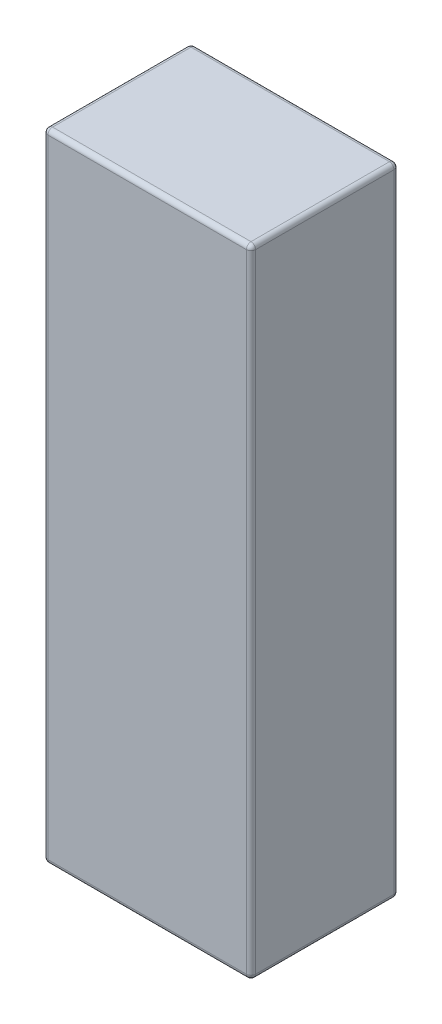
from build123d import *

# Parameters (mm, degrees)
SKETCH1_W           = 45
SKETCH1_H           = 138
BOSS_EXTRUDE1_DEPTH = 32
FILLET1_R           = 1
CUT_EXTRUDE1_DEPTH  = 2


with BuildPart() as part:
    # Sketch1 → Boss-Extrude1 (new body)
    with BuildSketch(Plane.XY):
        Rectangle(SKETCH1_W, SKETCH1_H)
    extrude(amount=BOSS_EXTRUDE1_DEPTH)

    # Fillet1
    fillet1_edges = [part.edges().sort_by_distance(p)[0] for p in [
        (-22.5, 0, 32),
        (0, -69, 32),
        (22.5, 0, 32),
        (0, -69, 0),
        (-22.5, 0, 0),
        (0, 69, 0),
        (22.5, 0, 0),
        (0, 69, 32),
        (22.5, -69, 16),
        (-22.5, -69, 16),
        (-22.5, 69, 16),
        (22.5, 69, 16),
    ]]
    fillet(fillet1_edges, radius=FILLET1_R)

    # Sketch2 → Cut-Extrude1 (cut)
    # profile 1 of 7: a face of its own
    with BuildSketch(Plane(origin=(0, 0, 0), x_dir=(-1, 0, 0), z_dir=(0, 0, -1))):
        with BuildLine():
            Line((-7.277134392, -1.295430919), (-7.277134392, 2.204569081))
            Line((-7.277134392, 2.204569081), (-6.716236956, 2.204569081))
            add(Edge.make_bspline(
                [(-6.716236956, 2.204569081), (-6.676970628, 2.204573562), (-6.600991029, 2.204582233), (-6.491372295, 2.200732783), (-6.389710178, 2.195753088), (-6.296328204, 2.190181968), (-6.211067432, 2.180581814), (-6.134057514, 2.1704643), (-6.065144584, 2.158263203), (-6.022539465, 2.14731844), (-6.002494969, 2.142169241)],
                knots=[0, 0, 0, 0, 1.311965854, 2.538629056, 3.664479157, 4.713267157, 5.663616078, 6.530575999, 7.308677837, 8, 8, 8, 8], degree=3))
            add(Edge.make_bspline(
                [(-6.002494969, 2.142169241), (-5.97617451, 2.134906204), (-5.924525321, 2.120653793), (-5.8505472, 2.091870433), (-5.780368633, 2.059875689), (-5.714075306, 2.023375669), (-5.652074286, 1.981929717), (-5.594601198, 1.935208904), (-5.540416491, 1.885088603), (-5.491444139, 1.830171975), (-5.447181202, 1.772142384), (-5.408724645, 1.711015037), (-5.375310826, 1.64772461), (-5.348571019, 1.581474634), (-5.328423077, 1.512570211), (-5.313686956, 1.441305571), (-5.304135954, 1.367455215), (-5.30323351, 1.317212405), (-5.302775417, 1.291708504)],
                knots=[0, 0, 0, 0, 1.099996261, 2.158545794, 3.195537121, 4.207578794, 5.205712374, 6.197378256, 7.190519799, 8.17788031, 9.159561366, 10.129234751, 11.085776129, 12.040971148, 13.00380137, 13.975669004, 14.972423361, 16, 16, 16, 16], degree=3))
            add(Edge.make_bspline(
                [(-5.302775417, 1.291708504), (-5.303973193, 1.258942685), (-5.306330867, 1.194447196), (-5.321391852, 1.099714991), (-5.349633544, 1.010179442), (-5.386587111, 0.924190441), (-5.436832408, 0.842068729), (-5.500634219, 0.763853351), (-5.576959163, 0.68713594), (-5.635504607, 0.641149027), (-5.665956507, 0.617229337)],
                knots=[0, 0, 0, 0, 0.986156485, 1.941127874, 2.875419072, 3.804401753, 4.751181392, 5.761612777, 6.835722519, 8, 8, 8, 8], degree=3))
            add(Edge.make_bspline(
                [(-5.665956507, 0.617229337), (-5.641279749, 0.604632066), (-5.592895452, 0.579932302), (-5.524203966, 0.539333264), (-5.460603148, 0.496151038), (-5.401807831, 0.451254467), (-5.349051315, 0.402740322), (-5.300155194, 0.353404053), (-5.25753175, 0.300418899), (-5.219416581, 0.24567335), (-5.186287496, 0.188374684), (-5.157435716, 0.128619667), (-5.133065652, 0.066204162), (-5.112428452, 0.001445813), (-5.097037222, -0.065878117), (-5.087001814, -0.135791707), (-5.079318077, -0.208056517), (-5.078720355, -0.2572815), (-5.078416443, -0.282309926)],
                knots=[0, 0, 0, 0, 1.164658916, 2.283573913, 3.35186032, 4.395461096, 5.390182219, 6.362969632, 7.312859996, 8.245001507, 9.165155236, 10.092416118, 11.032087915, 11.979892451, 12.947605196, 13.931445124, 14.948243989, 16, 16, 16, 16], degree=3))
            add(Edge.make_bspline(
                [(-5.078416443, -0.282309926), (-5.080388627, -0.330112788), (-5.084280725, -0.424451545), (-5.112737846, -0.562962506), (-5.162073451, -0.694283461), (-5.228320996, -0.817892482), (-5.309950717, -0.930211293), (-5.403801487, -1.028601596), (-5.508928445, -1.111886803), (-5.60592077, -1.168097857), (-5.689811493, -1.20582073), (-5.759296611, -1.22914339), (-5.833922155, -1.250749466), (-5.915055086, -1.265921699), (-6.001224574, -1.279808995), (-6.093270777, -1.288383299), (-6.191021663, -1.294193894), (-6.258161197, -1.295010241), (-6.292759392, -1.295430919)],
                knots=[0, 0, 0, 0, 1.284142165, 2.534249414, 3.780121997, 5.041676246, 6.291546858, 7.49970053, 8.684500223, 9.883330709, 10.50184324, 11.153274765, 11.851151195, 12.587658647, 13.369265475, 14.195992086, 15.070362669, 16, 16, 16, 16], degree=3))
            Line((-6.292759392, -1.295430919), (-7.277134392, -1.295430919))
        make_face()
        with BuildLine():
            Line((-6.648929264, 1.576363952), (-6.648929264, 0.81354344))
            Line((-6.648929264, 0.81354344), (-6.482062276, 0.81354344))
            add(Edge.make_bspline(
                [(-6.482062276, 0.81354344), (-6.459383554, 0.813741207), (-6.415603652, 0.814122984), (-6.352368227, 0.819040143), (-6.293569495, 0.827429122), (-6.239430465, 0.839133858), (-6.189446813, 0.853997166), (-6.14393785, 0.871880927), (-6.103103669, 0.893701059), (-6.055663795, 0.926203108), (-6.005516427, 0.974031329), (-5.961372263, 1.043129103), (-5.935371645, 1.122591281), (-5.932475878, 1.178634161), (-5.930980546, 1.207573888)],
                knots=[0, 0, 0, 0, 1.065314748, 2.056525647, 2.977365736, 3.853934255, 4.656397591, 5.425096493, 6.14721249, 6.826394842, 8.123232004, 9.372140726, 10.643011755, 12, 12, 12, 12], degree=3))
            add(Edge.make_bspline(
                [(-5.930980546, 1.207573888), (-5.932177085, 1.234680751), (-5.934490546, 1.287090781), (-5.960669825, 1.36067913), (-6.001331421, 1.425893468), (-6.04933815, 1.470527349), (-6.094545815, 1.501010974), (-6.133255391, 1.521083143), (-6.175742057, 1.539051544), (-6.222828311, 1.55279062), (-6.274245262, 1.56309994), (-6.329743152, 1.570670901), (-6.389417732, 1.575824019), (-6.430635091, 1.576180114), (-6.451914039, 1.576363952)],
                knots=[0, 0, 0, 0, 1.347982417, 2.606269829, 3.849316587, 5.153353503, 5.842674298, 6.568177932, 7.326619318, 8.142485038, 9.012069166, 9.942760135, 10.937925643, 12, 12, 12, 12], degree=3))
            Line((-6.451914039, 1.576363952), (-6.648929264, 1.576363952))
        make_face(mode=Mode.SUBTRACT)
        with BuildLine():
            Line((-6.648929264, 0.230210106), (-6.648929264, -0.667225791))
            Line((-6.648929264, -0.667225791), (-6.46803984, -0.667225791))
            add(Edge.make_bspline(
                [(-6.46803984, -0.667225791), (-6.432277771, -0.667021484), (-6.36352073, -0.666628677), (-6.265026392, -0.661882642), (-6.175470414, -0.653328749), (-6.095090087, -0.642649902), (-6.023762293, -0.628181736), (-5.961728137, -0.609787316), (-5.908136902, -0.589550251), (-5.863309922, -0.564555072), (-5.826688848, -0.535466883), (-5.793642168, -0.505738054), (-5.766697964, -0.471443042), (-5.745379207, -0.434054036), (-5.72692786, -0.394499806), (-5.715799311, -0.351235773), (-5.707326425, -0.305544179), (-5.706860139, -0.273940292), (-5.706621571, -0.257770663)],
                knots=[0, 0, 0, 0, 1.753078804, 3.370512758, 4.83203934, 6.162291463, 7.344201807, 8.395507345, 9.331626367, 10.147333109, 10.898971645, 11.62040215, 12.321813352, 13.025280112, 13.727906689, 14.453419512, 15.208716525, 16, 16, 16, 16], degree=3))
            add(Edge.make_bspline(
                [(-5.706621571, -0.257770663), (-5.707147681, -0.239280437), (-5.708172403, -0.203266452), (-5.716541313, -0.150628169), (-5.731750356, -0.101486839), (-5.750906888, -0.054585852), (-5.77756422, -0.011604427), (-5.809245549, 0.02894486), (-5.847524681, 0.065688886), (-5.890571799, 0.100850065), (-5.940782, 0.131635583), (-5.998178841, 0.158347473), (-6.063074133, 0.180656259), (-6.135668897, 0.19841853), (-6.215644882, 0.213493123), (-6.303585825, 0.222494319), (-6.398759324, 0.229188905), (-6.464754177, 0.229861971), (-6.498889199, 0.230210106)],
                knots=[0, 0, 0, 0, 0.845221588, 1.646264278, 2.427170338, 3.19324141, 3.95557735, 4.731569926, 5.540061037, 6.376114724, 7.268642756, 8.224665384, 9.265483498, 10.400594375, 11.639216012, 12.983232105, 14.439614077, 16, 16, 16, 16], degree=3))
            Line((-6.498889199, 0.230210106), (-6.648929264, 0.230210106))
        make_face(mode=Mode.SUBTRACT)
    # profile 2 of 7: a face of its own
    with BuildSketch(Plane(origin=(0, 0, 0), x_dir=(-1, 0, 0), z_dir=(0, 0, -1))):
        Polygon((-3.372587116, 2.204569081), (-2.789954905, 2.204569081), (-1.376493366, -1.295430919), (-2.047466924, -1.295430919), (-2.31950218, -0.577482201), (-3.844442084, -0.577482201), (-4.11647734, -1.295430919), (-4.786749776, -1.295430919), align=None)
        Polygon((-3.081621571, 1.265766997), (-3.606060674, 0.050722927), (-2.557182469, 0.050722927), align=None, mode=Mode.SUBTRACT)
    # profile 3 of 7: a face of its own
    with BuildSketch(Plane(origin=(0, 0, 0), x_dir=(-1, 0, 0), z_dir=(0, 0, -1))):
        Polygon((-1.219442084, 2.204569081), (0.665173301, 2.204569081), (0.665173301, 1.576363952), (0.036968172, 1.576363952), (0.036968172, -1.295430919), (-0.591236956, -1.295430919), (-0.591236956, 1.576363952), (-1.219442084, 1.576363952), align=None)
    # profile 4 of 7: a face of its own
    with BuildSketch(Plane(origin=(0, 0, 0), x_dir=(-1, 0, 0), z_dir=(0, 0, -1))):
        Polygon((0.799788685, 2.204569081), (2.68440407, 2.204569081), (2.68440407, 1.576363952), (2.056198942, 1.576363952), (2.056198942, -1.295430919), (1.427993813, -1.295430919), (1.427993813, 1.576363952), (0.799788685, 1.576363952), align=None)
    # profile 5 of 7: a face of its own
    with BuildSketch(Plane(origin=(0, 0, 0), x_dir=(-1, 0, 0), z_dir=(0, 0, -1))):
        Polygon((3.177993813, 2.204569081), (5.062609198, 2.204569081), (5.062609198, 1.576363952), (3.806198942, 1.576363952), (3.806198942, 0.903287029), (5.062609198, 0.903287029), (5.062609198, 0.275081901), (3.806198942, 0.275081901), (3.806198942, -0.667225791), (5.062609198, -0.667225791), (5.062609198, -1.295430919), (3.177993813, -1.295430919), align=None)
    # profile 6 of 7: a face of its own
    with BuildSketch(Plane(origin=(0, 0, 0), x_dir=(-1, 0, 0), z_dir=(0, 0, -1))):
        with BuildLine():
            Line((5.690814326, 2.204569081), (6.42278548, 2.204569081))
            add(Edge.make_bspline(
                [(6.42278548, 2.204569081), (6.471168551, 2.204397348), (6.564222824, 2.204067059), (6.698402003, 2.19885597), (6.821664032, 2.19160431), (6.934191412, 2.180538086), (7.035936, 2.165865611), (7.126999769, 2.14856919), (7.207380057, 2.12885621), (7.277754761, 2.104292282), (7.341264452, 2.076584544), (7.400464313, 2.044747844), (7.456660382, 2.009136696), (7.509477048, 1.968814072), (7.559373301, 1.924505367), (7.606443273, 1.87616598), (7.650021822, 1.823386013), (7.689839107, 1.766498968), (7.726129357, 1.706655101), (7.758202327, 1.643772246), (7.78428412, 1.577806673), (7.80733018, 1.509711726), (7.82392951, 1.438513975), (7.835474101, 1.364906542), (7.843926599, 1.288630321), (7.844412577, 1.236811643), (7.84466048, 1.210378375)],
                knots=[0, 0, 0, 0, 1.749336639, 3.364467119, 4.854658419, 6.213483162, 7.451590619, 8.570285859, 9.5643256, 10.440900261, 11.26203566, 12.067320669, 12.869050712, 13.665104639, 14.467235401, 15.27997916, 16.102287765, 16.939272006, 17.78853747, 18.631303466, 19.488103222, 20.351255419, 21.228522269, 22.127379805, 23.044756219, 24, 24, 24, 24], degree=3))
            add(Edge.make_bspline(
                [(7.84466048, 1.210378375), (7.844016518, 1.182788117), (7.842753825, 1.128688648), (7.835952277, 1.049220941), (7.823521183, 0.973191798), (7.804692482, 0.900823822), (7.783051336, 0.83121631), (7.754274164, 0.765653563), (7.721796281, 0.703182067), (7.683223247, 0.644685504), (7.640891228, 0.58886455), (7.59165998, 0.537857911), (7.538718931, 0.488924175), (7.479092074, 0.445128384), (7.415407815, 0.403509225), (7.346400814, 0.365791184), (7.272521436, 0.331026115), (7.220580575, 0.311638711), (7.194019454, 0.301724529)],
                knots=[0, 0, 0, 0, 1.099860209, 2.156625411, 3.176576793, 4.16617041, 5.135385252, 6.078461593, 7.016046972, 7.938469504, 8.868247731, 9.803980173, 10.76021508, 11.73834243, 12.748633912, 13.790971185, 14.870363756, 16, 16, 16, 16], degree=3))
            Line((7.194019454, 0.301724529), (8.001711762, -1.295430919))
            Line((8.001711762, -1.295430919), (7.303394454, -1.295430919))
            Line((7.303394454, -1.295430919), (6.53216048, 0.230210106))
            Line((6.53216048, 0.230210106), (6.319019454, 0.230210106))
            Line((6.319019454, 0.230210106), (6.319019454, -1.295430919))
            Line((6.319019454, -1.295430919), (5.690814326, -1.295430919))
            Line((5.690814326, -1.295430919), (5.690814326, 2.204569081))
        make_face()
        with BuildLine():
            Line((6.319019454, 0.858415234), (6.563710961, 0.858415234))
            add(Edge.make_bspline(
                [(6.563710961, 0.858415234), (6.593626531, 0.858752164), (6.650908421, 0.859397311), (6.733287302, 0.862389771), (6.808106972, 0.86960012), (6.875688733, 0.878710128), (6.936372649, 0.889228946), (6.989617441, 0.904303053), (7.03624353, 0.920455339), (7.075698396, 0.940528441), (7.109407727, 0.963355912), (7.138513577, 0.989288486), (7.162588288, 1.019302139), (7.182403003, 1.052581228), (7.197816697, 1.089420099), (7.209067513, 1.129414345), (7.215355055, 1.173019552), (7.216078458, 1.203113083), (7.216455352, 1.218791837)],
                knots=[0, 0, 0, 0, 1.688639943, 3.233382647, 4.650958383, 5.928841754, 7.082724185, 8.122798841, 9.049171256, 9.863274652, 10.613301712, 11.341792392, 12.054588806, 12.776240173, 13.521029143, 14.301969904, 15.115324896, 16, 16, 16, 16], degree=3))
            add(Edge.make_bspline(
                [(7.216455352, 1.218791837), (7.2157428, 1.237340948), (7.214343124, 1.27377724), (7.200453986, 1.326232723), (7.178345479, 1.374783862), (7.148040772, 1.419211291), (7.109875933, 1.458159441), (7.066078769, 1.492492546), (7.015704032, 1.519640596), (6.969060816, 1.537547161), (6.926626392, 1.548260844), (6.888330664, 1.556244585), (6.843983979, 1.561902892), (6.793552859, 1.567904534), (6.737165855, 1.571796294), (6.674515624, 1.574636504), (6.605782096, 1.575798573), (6.557868299, 1.576170066), (6.532861602, 1.576363952)],
                knots=[0, 0, 0, 0, 1.020303359, 2.004196876, 2.966617323, 3.9489082, 4.950758222, 5.960522915, 7.003732012, 8.091992268, 8.70421221, 9.413913587, 10.24622431, 11.166358409, 12.212345909, 13.359657661, 14.621978493, 16, 16, 16, 16], degree=3))
            Line((6.532861602, 1.576363952), (6.319019454, 1.576363952))
            Line((6.319019454, 1.576363952), (6.319019454, 0.858415234))
        make_face(mode=Mode.SUBTRACT)
    # profile 7 of 7: a face of its own
    with BuildSketch(Plane(origin=(0, 0, 0), x_dir=(-1, 0, 0), z_dir=(0, 0, -1))):
        Polygon((8.226070736, 2.204569081), (8.925089166, 2.204569081), (9.549788685, 0.976904818), (10.174488204, 2.204569081), (10.873506634, 2.204569081), (9.863891249, 0.220394401), (9.863891249, -1.295430919), (9.235686121, -1.295430919), (9.235686121, 0.220394401), align=None)
    extrude(amount=-CUT_EXTRUDE1_DEPTH, mode=Mode.SUBTRACT)


solid = part.part
